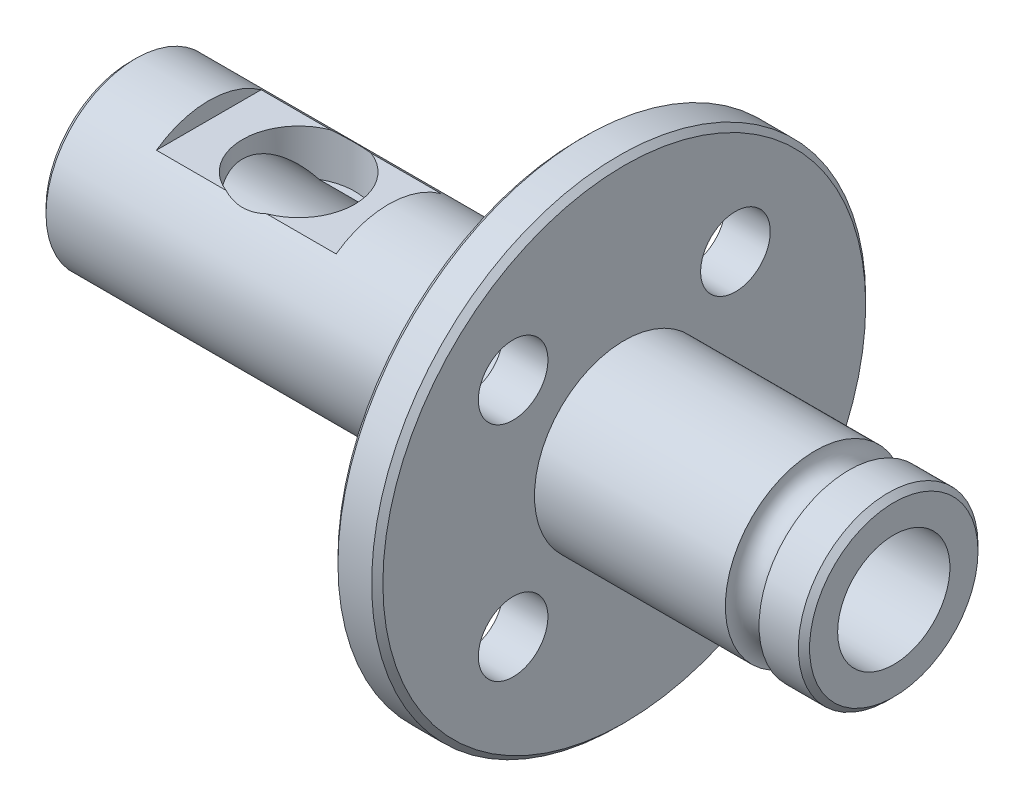
from build123d import *

# Parameters (mm, degrees)
SKETCH3_R          = 1.55
CUT_EXTRUDE1_DEPTH = 10
SKETCH4_R          = 2.5
CUT_EXTRUDE2_DEPTH = 38.389838192
SKETCH6_W          = 8
SKETCH6_H          = 5
CUT_EXTRUDE4_DEPTH = 0.75
SKETCH8_R          = 2.5
CUT_EXTRUDE5_DEPTH = 2
CHAMFER1_SIZE      = 0.25


with BuildPart() as part:
    # Sketch2 → Revolve1 (revolve)
    with BuildSketch(Plane.XY, mode=Mode.PRIVATE) as revolve1_sk:
        with BuildLine():
            Line((0, 0), (0, 4))
            Line((0, 4), (20, 4))
            Line((20, 4), (20, 11))
            Line((20, 11), (22, 11))
            Line((22, 11), (22, 4))
            Line((22, 4), (30.5, 4))
            ThreePointArc((30.5, 4), (31.25, 3.25), (32, 4))
            Line((32, 4), (34, 4))
            Line((34, 4), (34, 0))
            Line((34, 0), (0, 0))
        make_face()
    revolve(revolve1_sk.sketch.rotate(Axis((34, 0, 0), (-1, 0, 0)), 90), axis=Axis((34, 0, 0), (-1, 0, 0)))

    # Sketch3 → Cut-Extrude1 (cut)
    with BuildSketch(Plane(origin=(22, 0, 0), x_dir=(0, 0, -1), z_dir=(1, 0, 0))):
        with Locations((4.949747468, 4.949747468)):
            Circle(SKETCH3_R)
        with Locations((4.949747468, -4.949747468)):
            Circle(SKETCH3_R)
        with Locations((-4.949747468, -4.949747468)):
            Circle(SKETCH3_R)
        with Locations((-4.949747468, 4.949747468)):
            Circle(SKETCH3_R)
    extrude(amount=-CUT_EXTRUDE1_DEPTH, mode=Mode.SUBTRACT)

    # Sketch4 → Cut-Extrude2 (cut, through all)
    with BuildSketch(Plane.ZY):
        Circle(SKETCH4_R)
    extrude(amount=-CUT_EXTRUDE2_DEPTH, mode=Mode.SUBTRACT)

    # Sketch6 → Cut-Extrude4 (cut)
    with BuildSketch(Plane(origin=(0, 4, 0), x_dir=(1, 0, 0), z_dir=(0, 1, 0))):
        with Locations((7.5, 0)):
            Rectangle(SKETCH6_W, SKETCH6_H)
    extrude(amount=-CUT_EXTRUDE4_DEPTH, mode=Mode.SUBTRACT)

    # Sketch8 → Cut-Extrude5 (cut)
    with BuildSketch(Plane(origin=(0, 3.25, 0), x_dir=(1, 0, 0), z_dir=(0, 1, 0))):
        with Locations(Location((7.5, 0, 0), (0, 0, 248.865707785))):
            Circle(SKETCH8_R)
    extrude(amount=-CUT_EXTRUDE5_DEPTH, mode=Mode.SUBTRACT)

    # Chamfer1
    chamfer1_edges = [part.edges().sort_by_distance(p)[0] for p in [
        (34, 0, 4),
        (0, 0, 4),
        (20, 0, 11),
        (22, 0, 11),
    ]]
    chamfer(chamfer1_edges, length=CHAMFER1_SIZE)


solid = part.part
